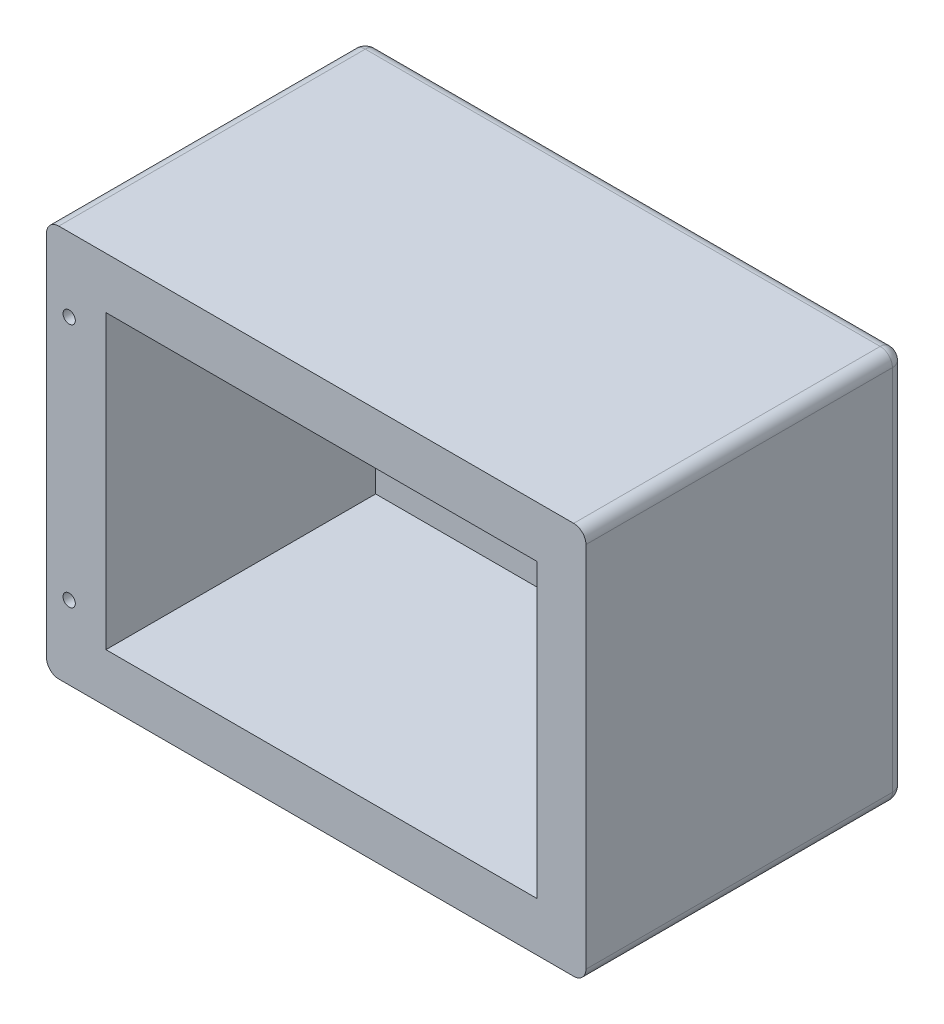
from build123d import *

# Parameters (mm, degrees)
SKETCH_1_W          = 440
SKETCH_1_H          = 320
EXTRUDE_1_DEPTH     = 260
SKETCH_6_W          = 351.529236831
SKETCH_6_H          = 238.132708821
CUT_EXTRUDE_1_DEPTH = 220
FILLET_1_R          = 10
SKETCH_7_R          = 5
CUT_EXTRUDE_2_DEPTH = 10


with BuildPart() as part:
    # 草图1 → 凸台-拉伸1 (new body)
    with BuildSketch(Plane.XY):
        with Locations((220, -160)):
            Rectangle(SKETCH_1_W, SKETCH_1_H)
    extrude(amount=EXTRUDE_1_DEPTH)

    # 草图6 → 切除-拉伸1 (cut)
    with BuildSketch(Plane.XY.offset(260)):
        with Locations((224.235381585, -160.93364559)):
            Rectangle(SKETCH_6_W, SKETCH_6_H)
    extrude(amount=-CUT_EXTRUDE_1_DEPTH, mode=Mode.SUBTRACT)

    # 圆角1
    fillet_1_edges = [part.edges().sort_by_distance(p)[0] for p in [
        (220, 0, 0),
        (440, -160, 0),
        (220, -320, 0),
        (0, -160, 0),
        (0, 0, 130),
        (440, 0, 130),
        (440, -320, 130),
        (0, -320, 130),
    ]]
    fillet(fillet_1_edges, radius=FILLET_1_R)

    # 草图7 → 切除-拉伸2 (cut)
    with BuildSketch(Plane.XY.offset(260)):
        with Locations((18.470763169, -60)):
            Circle(SKETCH_7_R)
        with Locations((18.470763169, -260)):
            Circle(SKETCH_7_R)
    extrude(amount=-CUT_EXTRUDE_2_DEPTH, mode=Mode.SUBTRACT)


solid = part.part
